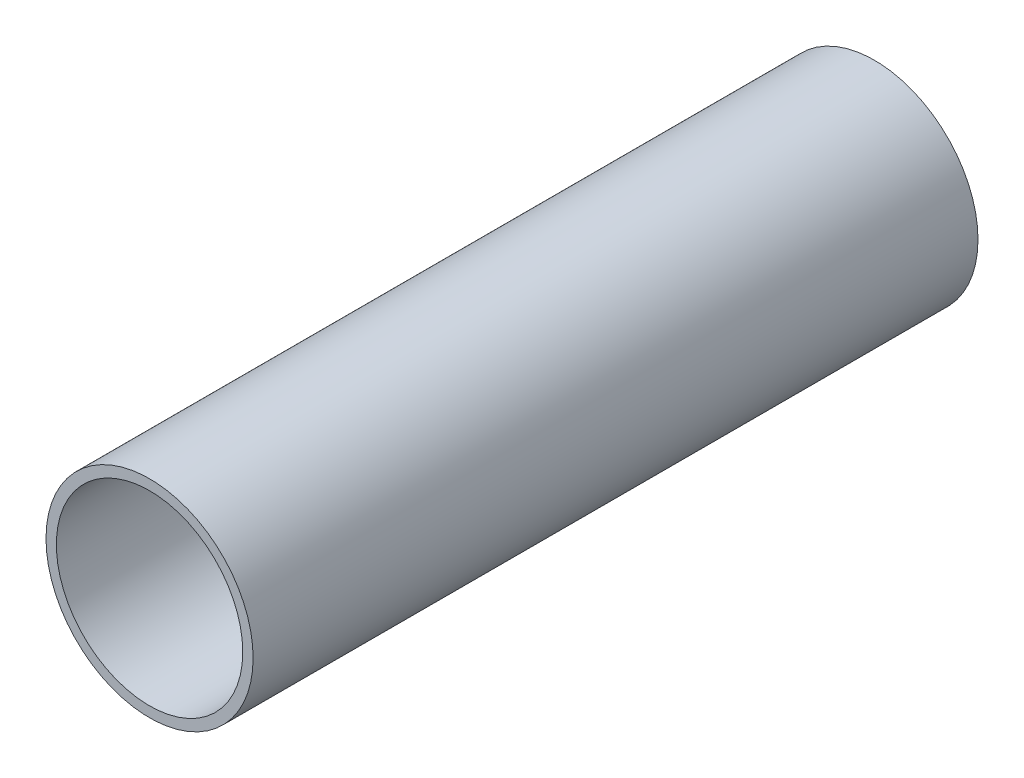
from build123d import *

# Parameters (mm, degrees)
SKETCH1_R           = 2
SKETCH1_R_2         = 1.8
BOSS_EXTRUDE1_DEPTH = 14


with BuildPart() as part:
    # Sketch1 → Boss-Extrude1 (new body)
    with BuildSketch(Plane.XY):
        Circle(SKETCH1_R)
        Circle(SKETCH1_R_2, mode=Mode.SUBTRACT)
    extrude(amount=BOSS_EXTRUDE1_DEPTH)


solid = part.part
